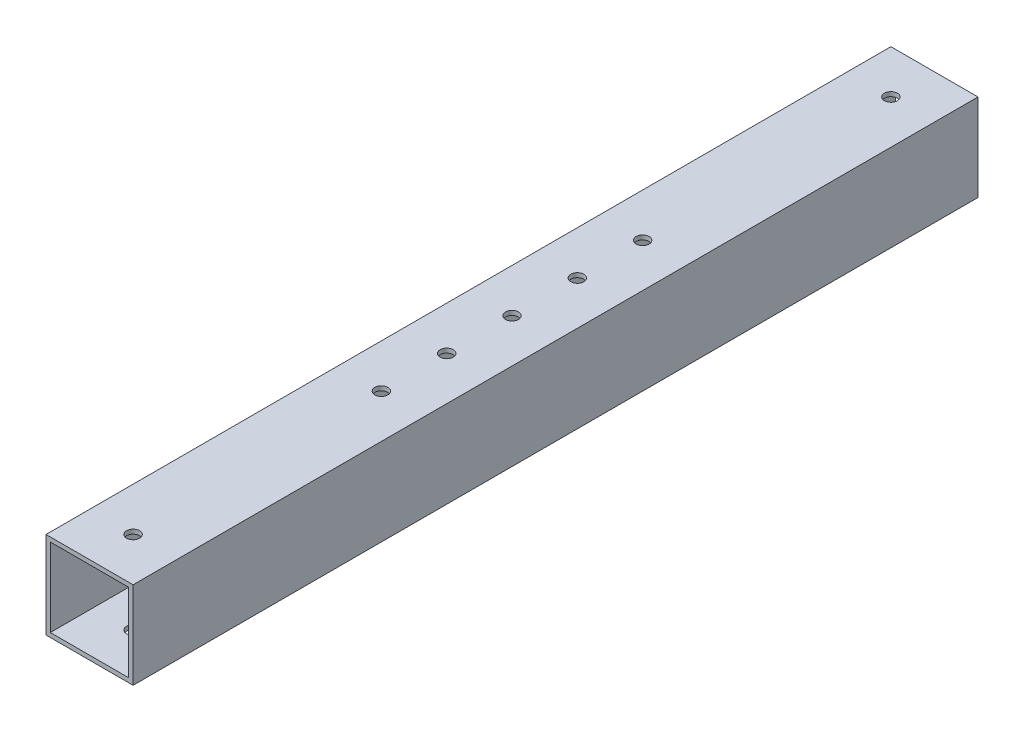
from build123d import *

# Parameters (mm, degrees)
SKETCH_1_W          = 20
SKETCH_1_H          = 20
SKETCH_1_W_2        = 18
SKETCH_1_H_2        = 18
EXTRUDE_1_DEPTH     = 97
SKETCH_2_R          = 1.5
CUT_EXTRUDE_1_DEPTH = 166


with BuildPart() as part:
    # 草图1 → 凸台-拉伸1 (new, symmetric)
    with BuildSketch(Plane.XY):
        Rectangle(SKETCH_1_W, SKETCH_1_H)
        Rectangle(SKETCH_1_W_2, SKETCH_1_H_2, mode=Mode.SUBTRACT)
    extrude(amount=EXTRUDE_1_DEPTH, both=True)

    # 草图2 → 切除-拉伸1 (cut)
    with BuildSketch(Plane(origin=(0, 10, 0), x_dir=(1, 0, 0), z_dir=(0, 1, 0))):
        with Locations(Location((0, 87, 0), (0, 0, 270))):
            Circle(SKETCH_2_R)
        with Locations(Location((0, -87, 0), (0, 0, 270))):
            Circle(SKETCH_2_R)
        with Locations(Location((0, 0, 0), (0, 0, 270))):
            Circle(SKETCH_2_R)
        with Locations(Location((0, 15, 0), (0, 0, 270))):
            Circle(SKETCH_2_R)
        with Locations(Location((0, 30, 0), (0, 0, 270))):
            Circle(SKETCH_2_R)
        with Locations(Location((0, -30, 0), (0, 0, 270))):
            Circle(SKETCH_2_R)
        with Locations(Location((0, -15, 0), (0, 0, 270))):
            Circle(SKETCH_2_R)
    extrude(amount=-CUT_EXTRUDE_1_DEPTH, mode=Mode.SUBTRACT)


solid = part.part
